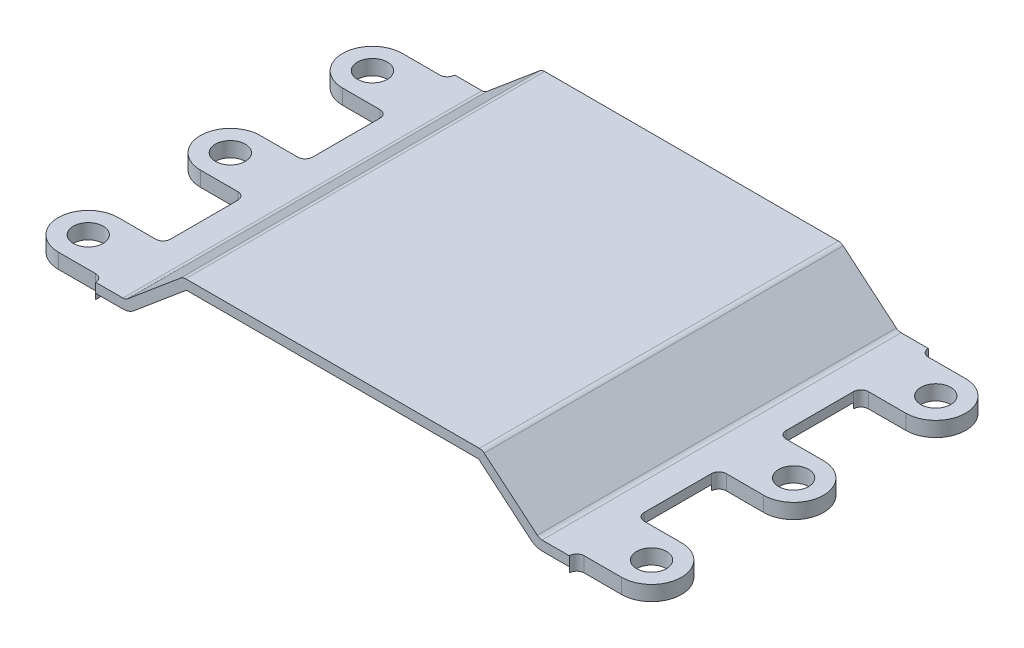
from build123d import *

# Parameters (mm, degrees)
EXTRUDE_THIN1_DEPTH       = 76.2
SKETCH2_R                 = 3.175
BOSS_EXTRUDE1_DEPTH       = 3.175
LPATTERN1_COUNT           = 3
LPATTERN1_PITCH           = 30.1625
LPATTERN1_COPY_1_SKETCH_R = 3.175
LPATTERN1_COPY_1_DEPTH    = 3.175
LPATTERN1_COPY_2_SKETCH_R = 3.175
LPATTERN1_COPY_2_DEPTH    = 3.175


with BuildPart() as part:
    # Sketch1 → Extrude-Thin1 (new body)
    with BuildSketch(Plane.XY):
        with BuildLine():
            Line((92.701547158, 0), (86.929349905, 0))
            ThreePointArc((86.929349905, 0), (86.386392927, 0.095737965), (85.908924574, 0.371404447))
            Line((85.908924574, 0.371404447), (74.641391347, 9.825987422))
            ThreePointArc((74.641391347, 9.825987422), (74.163922994, 10.101653904), (73.620966016, 10.197391869))
            Line((73.620966016, 10.197391869), (11.27657151, 10.197391869))
            ThreePointArc((11.27657151, 10.197391869), (10.733614533, 10.101653904), (10.25614618, 9.825987422))
            Line((10.25614618, 9.825987422), (-1.011387048, 0.371404447))
            ThreePointArc((-1.011387048, 0.371404447), (-1.488855401, 0.095737965), (-2.031812378, 0))
            Line((-2.031812378, 0), (-7.804009631, 0))
            Line((-7.804009631, 0), (-7.804009631, -2.032))
            Line((-7.804009631, -2.032), (-2.031812378, -2.032))
            ThreePointArc((-2.031812378, -2.032), (-0.793870469, -1.813717441), (0.294757375, -1.185197862))
            Line((0.294757375, -1.185197862), (11.438356279, 8.165391869))
            Line((11.438356279, 8.165391869), (73.459181247, 8.165391869))
            Line((73.459181247, 8.165391869), (84.602780151, -1.185197862))
            ThreePointArc((84.602780151, -1.185197862), (85.691407996, -1.813717441), (86.929349905, -2.032))
            Line((86.929349905, -2.032), (92.701547158, -2.032))
            Line((92.701547158, -2.032), (92.701547158, 0))
        make_face()
    extrude(amount=-EXTRUDE_THIN1_DEPTH)

    # Sketch2 → Boss-Extrude1 (add)
    with BuildSketch(Plane(origin=(0, 0, 0), x_dir=(1, 0, 0), z_dir=(0, 1, 0))):
        with BuildLine():
            Line((94.289047158, 1.5875), (102.226547158, 1.5875))
            ThreePointArc((102.226547158, 1.5875), (108.576547158, 7.9375), (102.226547158, 14.2875))
            Line((102.226547158, 14.2875), (94.289047158, 14.2875))
            ThreePointArc((94.289047158, 14.2875), (93.166515143, 14.752467985), (92.701547158, 15.875))
            Line((92.701547158, 15.875), (92.701547158, 0))
            ThreePointArc((92.701547158, 0), (93.166515143, 1.122532015), (94.289047158, 1.5875))
        make_face()
        with Locations(Location((102.226547158, 7.9375, 0), (0, 0, 270))):
            Circle(SKETCH2_R, mode=Mode.SUBTRACT)
    boss_extrude1 = extrude(amount=-BOSS_EXTRUDE1_DEPTH)

    # Mirror1: Boss-Extrude1 across plane
    add(boss_extrude1.mirror(Plane(origin=(42.448768763, 0, 0), x_dir=(0, 0, 1), z_dir=(1, 0, 0))))

    # LPattern1: Boss-Extrude1 ×3
    with Locations(*[(0, 0, -i * LPATTERN1_PITCH) for i in range(1, LPATTERN1_COUNT)]):
        add(boss_extrude1)

    # LPattern1 copy 1 sketch → LPattern1 copy 1 (add)
    with BuildSketch(Plane(origin=(84.897537526, 0, -30.1625), x_dir=(-1, 0, 0), z_dir=(0, 1, 0))):
        with BuildLine():
            Line((94.289047158, -1.5875), (102.226547158, -1.5875))
            ThreePointArc((102.226547158, -1.5875), (108.576547158, -7.9375), (102.226547158, -14.2875))
            Line((102.226547158, -14.2875), (94.289047158, -14.2875))
            ThreePointArc((94.289047158, -14.2875), (93.166515143, -14.752467985), (92.701547158, -15.875))
            Line((92.701547158, -15.875), (92.701547158, 0))
            ThreePointArc((92.701547158, 0), (93.166515143, -1.122532015), (94.289047158, -1.5875))
        make_face()
        with Locations((102.226547158, -7.9375)):
            Circle(LPATTERN1_COPY_1_SKETCH_R, mode=Mode.SUBTRACT)
    extrude(amount=-LPATTERN1_COPY_1_DEPTH)

    # LPattern1 copy 2 sketch → LPattern1 copy 2 (add)
    with BuildSketch(Plane(origin=(84.897537526, 0, -60.325), x_dir=(-1, 0, 0), z_dir=(0, 1, 0))):
        with BuildLine():
            Line((94.289047158, -1.5875), (102.226547158, -1.5875))
            ThreePointArc((102.226547158, -1.5875), (108.576547158, -7.9375), (102.226547158, -14.2875))
            Line((102.226547158, -14.2875), (94.289047158, -14.2875))
            ThreePointArc((94.289047158, -14.2875), (93.166515143, -14.752467985), (92.701547158, -15.875))
            Line((92.701547158, -15.875), (92.701547158, 0))
            ThreePointArc((92.701547158, 0), (93.166515143, -1.122532015), (94.289047158, -1.5875))
        make_face()
        with Locations((102.226547158, -7.9375)):
            Circle(LPATTERN1_COPY_2_SKETCH_R, mode=Mode.SUBTRACT)
    extrude(amount=-LPATTERN1_COPY_2_DEPTH)


solid = part.part
